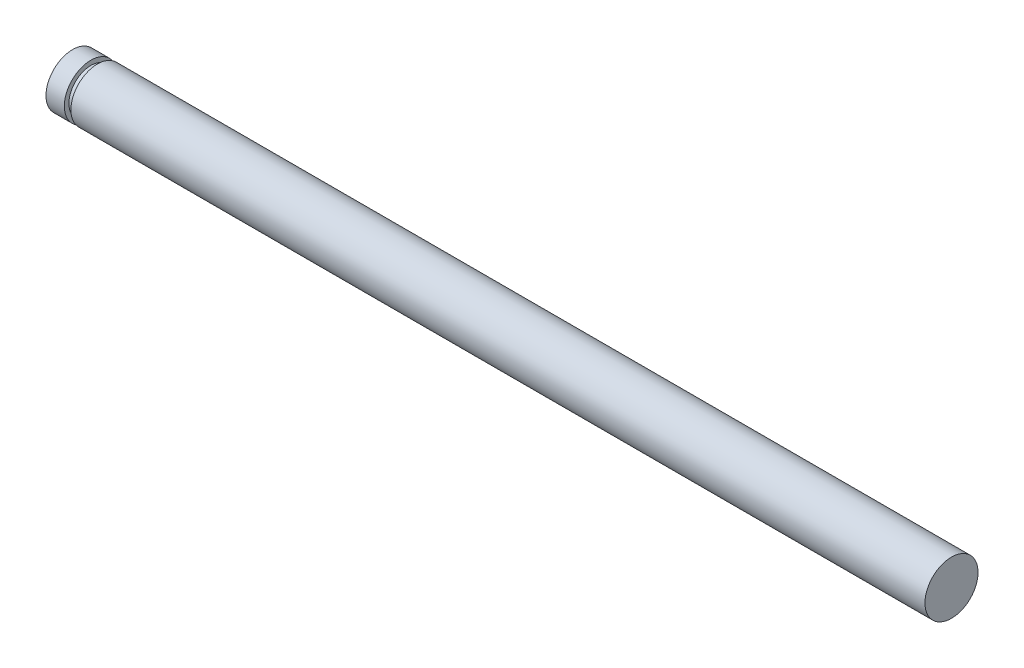
from build123d import *


with BuildPart() as part:
    # Sketch1 → Revolve1 (revolve)
    with BuildSketch(Plane.XY, mode=Mode.PRIVATE) as revolve1_sk:
        Polygon((-12.198895028, 0), (-12.198895028, 0.725), (-11.698895028, 0.725), (-11.698895028, 0.6), (-11.518895028, 0.6), (-11.518895028, 0.725), (11.801104972, 0.725), (11.801104972, 0), align=None)
    revolve(revolve1_sk.sketch.rotate(Axis((-12.198895028, 0, 0), (1, 0, 0)), 90), axis=Axis((-12.198895028, 0, 0), (1, 0, 0)))


solid = part.part
